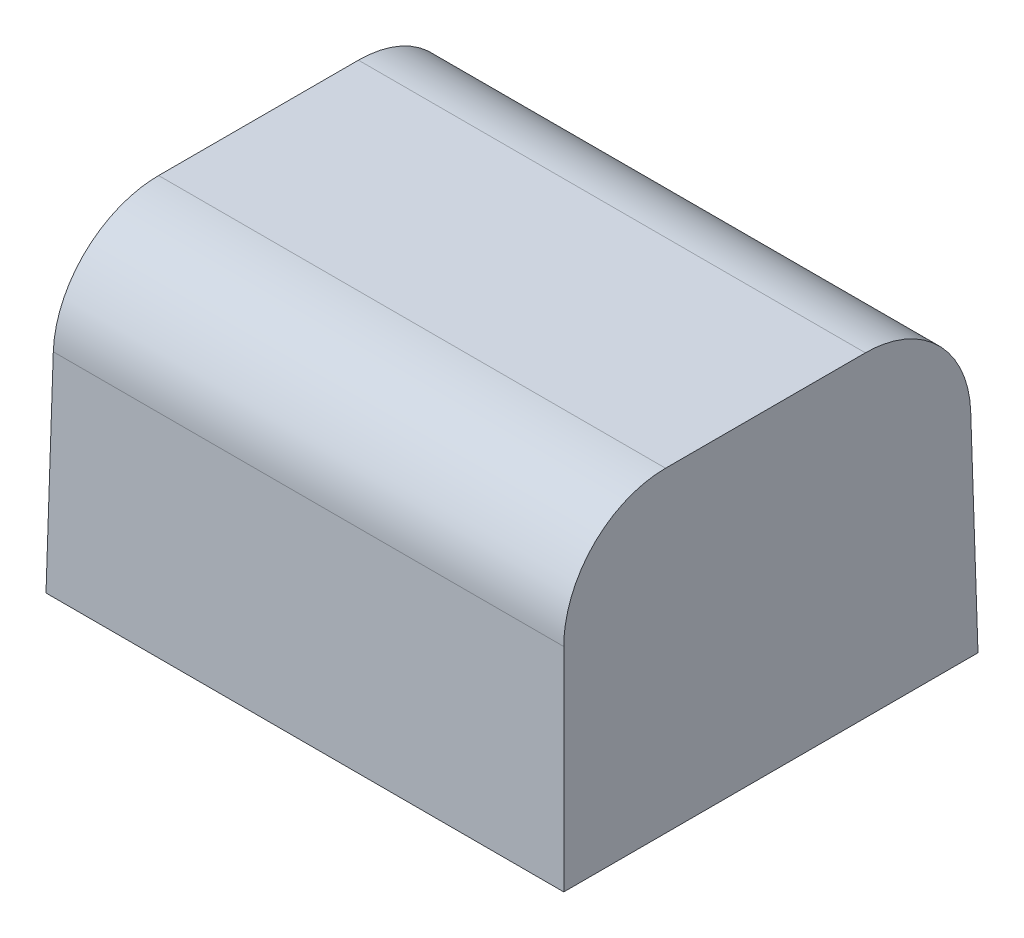
from build123d import *

# Parameters (mm, degrees)
ESBO_O1_W                = 50
ESBO_O1_H                = 40
RESSALTO_EXTRUS_O1_DEPTH = 30
RESSALTO_EXTRUS_O1_TAPER = 1
FILETE2_R                = 10


with BuildPart() as part:
    # Esboço1 → Ressalto-extrusão1 (new body)
    with BuildSketch(Plane(origin=(0, 0, 0), x_dir=(1, 0, 0), z_dir=(0, 1, 0))):
        with Locations((25, 20)):
            Rectangle(ESBO_O1_W, ESBO_O1_H)
    extrude(amount=RESSALTO_EXTRUS_O1_DEPTH, taper=RESSALTO_EXTRUS_O1_TAPER)

    # Filete2
    filete2_edges = [part.edges().sort_by_distance(p)[0] for p in [
        (25, 30, -39.476348052),
        (25, 30, -0.523651948),
    ]]
    fillet(filete2_edges, radius=FILETE2_R)


solid = part.part
